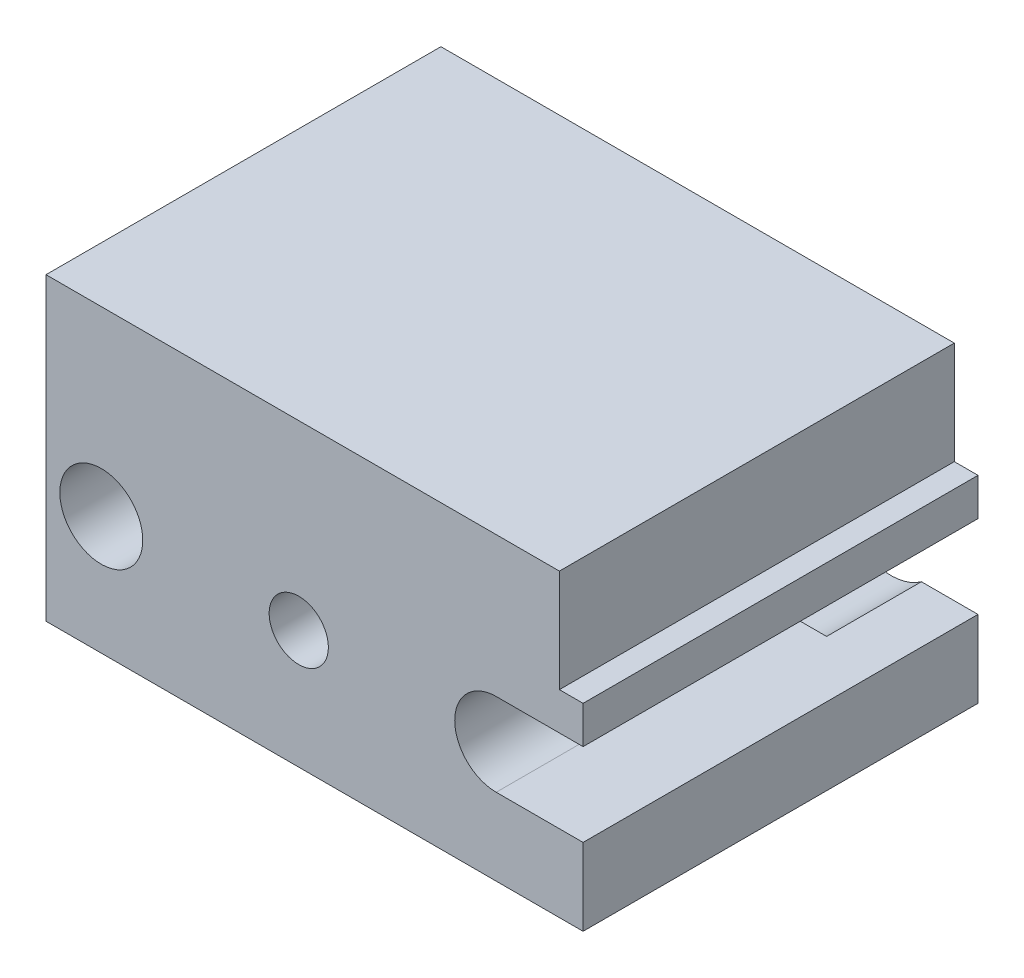
from build123d import *

# Parameters (mm, degrees)
SKETCH1_W                = 6.8
SKETCH1_H                = 5
BOSS_EXTRUDE1_DEPTH      = 3.8
HOLE1_D                  = 1.05
HOLE1_CBORE_D            = 1.3
HOLE1_CBORE_DEPTH        = 1.2
CUT_EXTRUDE8_DEPTH       = 10.340235543
SKETCH20_W               = 5
SKETCH20_H               = 1.3
CUT_EXTRUDE11_DEPTH      = 0.3
M1_0X0_25_TAPPED_HOLE1_D = 0.75


with BuildPart() as part:
    # Sketch1 → Boss-Extrude1 (new body)
    with BuildSketch(Plane(origin=(0, 4, 0), x_dir=(-1, 0, 0), z_dir=(0, 1, 0))):
        with Locations((-3.4, 2.5)):
            Rectangle(SKETCH1_W, SKETCH1_H)
    extrude(amount=-BOSS_EXTRUDE1_DEPTH)

    # Hole1 (through all)
    with Locations(Plane(origin=(0, 0, 0), x_dir=(-1, 0, 0), z_dir=(0, 0, -1))):
        with Locations((-5.7, 1.7), (-0.7, 1.7)):
            CounterBoreHole(HOLE1_D / 2, HOLE1_CBORE_D / 2, HOLE1_CBORE_DEPTH)

    # Sketch17 → Cut-Extrude8 (cut, through all)
    with BuildSketch(Plane.XY.offset(5)):
        with BuildLine():
            Line((6.8, 2.225), (5.7, 2.225))
            ThreePointArc((5.7, 2.225), (6.07123106, 2.07123106), (6.225, 1.7))
            ThreePointArc((6.225, 1.7), (6.07123106, 1.32876894), (5.7, 1.175))
            Line((5.7, 1.175), (6.8, 1.175))
            Line((6.8, 1.175), (6.8, 2.225))
        make_face()
        with BuildLine():
            ThreePointArc((6.225, 1.7), (6.07123106, 2.07123106), (5.7, 2.225))
            Line((5.7, 2.225), (5.7, 1.175))
            ThreePointArc((5.7, 1.175), (6.07123106, 1.32876894), (6.225, 1.7))
        make_face()
        with BuildLine():
            Line((5.7, 1.175), (5.7, 2.225))
            ThreePointArc((5.7, 2.225), (5.175, 1.7), (5.7, 1.175))
        make_face()
    extrude(amount=-CUT_EXTRUDE8_DEPTH, mode=Mode.SUBTRACT)

    # Sketch20 → Cut-Extrude11 (cut)
    with BuildSketch(Plane(origin=(6.8, 0, 0), x_dir=(0, 0, -1), z_dir=(1, 0, 0))):
        with Locations((-2.5, 3.35)):
            Rectangle(SKETCH20_W, SKETCH20_H)
    extrude(amount=-CUT_EXTRUDE11_DEPTH, mode=Mode.SUBTRACT)

    # M1.0x0.25 Tapped Hole1 (through all)
    with Locations(Plane(origin=(0, 0, 0), x_dir=(-1, 0, 0), z_dir=(0, 0, -1))):
        with Locations((-3.2, 1.7)):
            Hole(M1_0X0_25_TAPPED_HOLE1_D / 2)


solid = part.part
